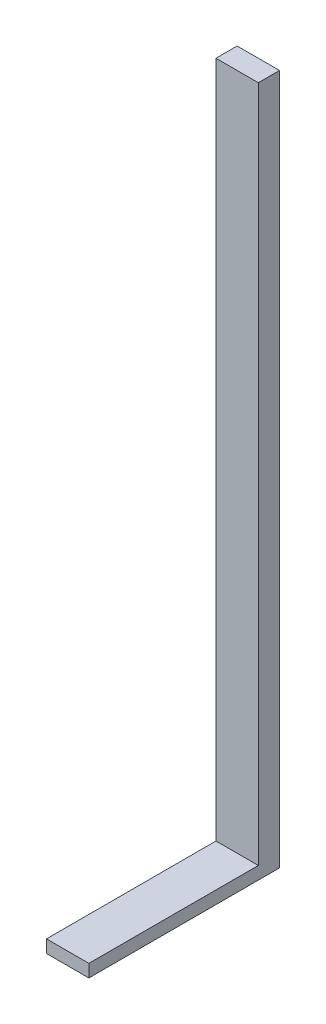
from build123d import *

# Parameters (mm, degrees)
BOSS_EXTRUDE1_DEPTH = 10


with BuildPart() as part:
    # Sketch1 → Boss-Extrude1 (new body)
    with BuildSketch(Plane(origin=(0, 0, 0), x_dir=(0, 0, -1), z_dir=(1, 0, 0))):
        Polygon((0, 0), (-45, 0), (-45, 3), (-5, 3), (-5, 163), (0, 163), align=None)
    extrude(amount=BOSS_EXTRUDE1_DEPTH)


solid = part.part
